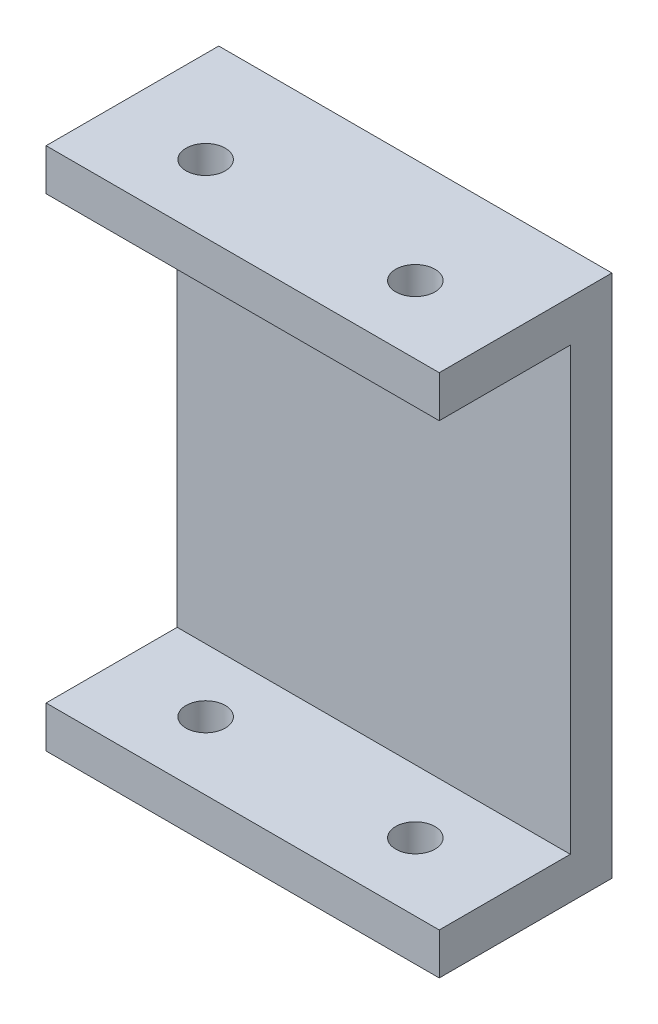
from build123d import *

# Parameters (mm, degrees)
SKETCH1_W               = 30
SKETCH1_H               = 40
BOSS_EXTRUDE1_DEPTH     = 3.175
SKETCH3_W               = 30
SKETCH3_H               = 3.175
BOSS_EXTRUDE2_DEPTH     = 10
CUT_EXTRUDE1_DEPTH      = 45.705487639
CUT_EXTRUDE1_DEPTH_BACK = 45.705487639
SKETCH4_R               = 1.5


with BuildPart() as part:
    # Sketch1 → Boss-Extrude1 (new body)
    with BuildSketch(Plane.XY):
        Rectangle(SKETCH1_W, SKETCH1_H)
    extrude(amount=BOSS_EXTRUDE1_DEPTH)

    # Sketch3 → Boss-Extrude2 (add)
    with BuildSketch(Plane.XY.offset(3.175)):
        with Locations((0, 18.4125)):
            Rectangle(SKETCH3_W, SKETCH3_H)
        with Locations((0, -18.4125)):
            Rectangle(SKETCH3_W, SKETCH3_H)
    extrude(amount=BOSS_EXTRUDE2_DEPTH)

    # Sketch4 → Cut-Extrude1 (cut, two sides: drawn at the far end of the back side and taken through both)
    with BuildSketch(Plane(origin=(0, 20, 0), x_dir=(1, 0, 0), z_dir=(0, 1, 0)).offset(-CUT_EXTRUDE1_DEPTH_BACK)):
        with Locations(Location((-8, -8, 0), (0, 0, 270))):
            Circle(SKETCH4_R)
        with Locations(Location((8, -8, 0), (0, 0, 270))):
            Circle(SKETCH4_R)
    extrude(amount=CUT_EXTRUDE1_DEPTH + CUT_EXTRUDE1_DEPTH_BACK, mode=Mode.SUBTRACT)


solid = part.part
